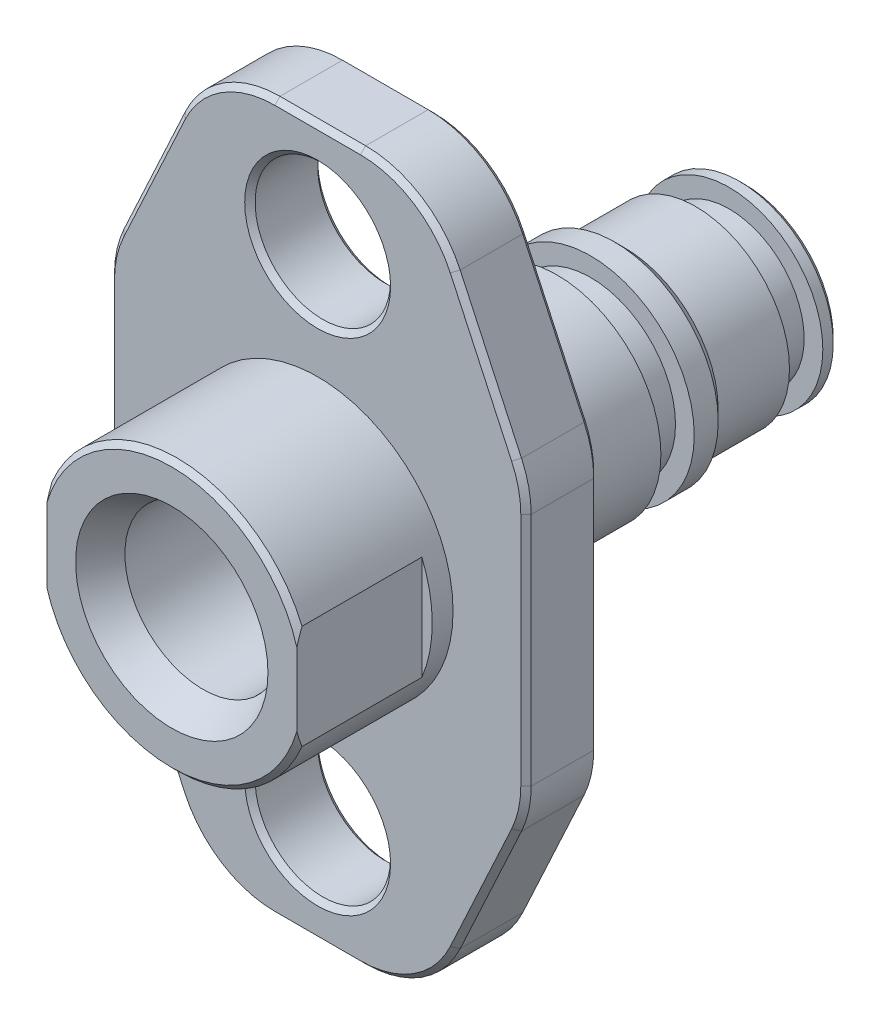
from build123d import *

# Parameters (mm, degrees)
SKETCH2_OUTSIDE_W  = 94.65
SKETCH2_OUTSIDE_H  = 94.65
SKETCH2_OUTSIDE_R  = 6.5
CUT_EXTRUDE1_DEPTH = 21
SKETCH5_W          = 2.091476768
SKETCH5_H          = 18
CUT_EXTRUDE2_DEPTH = 12
CIRPATTERN1_COUNT  = 2
CIRPATTERN1_ANGLE  = 180
CHAMFER1_SIZE      = 0.5


with BuildPart() as part:
    # Sketch1 → Revolve1 (revolve)
    with BuildSketch(Plane(origin=(0, 0, 0), x_dir=(0, 0, -1), z_dir=(1, 0, 0)), mode=Mode.PRIVATE) as revolve1_sk:
        Polygon((14, 35), (21, 35), (21, 9.95), (37, 9.95), (37, 8.15), (40.2, 8.15), (40.2, 9.95), (42.5, 9.95), (43.46, 8.99), (50.3, 8.99), (50.3, 7.2), (53.5, 7.2), (53.5, 8.99), (54.5, 8.99), (55, 8.49), (55, 4.75), (18.652366702, 4.75), (17, 7.5), (3, 7.5), (0, 9.232050808), (0, 12.5), (0.5, 13), (14, 13), align=None)
    revolve(revolve1_sk.sketch.rotate(Axis((0, 0, 0), (0, 0, -1)), 90), axis=Axis((0, 0, 0), (0, 0, -1)))

    # Sketch2 outside → Cut-Extrude1 (cut)
    # profile 1 of 3: a face of its own
    with BuildSketch(Plane.XY):
        Rectangle(SKETCH2_OUTSIDE_W, SKETCH2_OUTSIDE_H)
        with BuildLine():
            Line((-4.112562412, 34), (4.112562412, 34))
            ThreePointArc((4.112562412, 34), (9.495586596, 32.427517466), (13.185668477, 28.204610128))
            Line((13.185668477, 28.204610128), (19.073106065, 15.500139543))
            ThreePointArc((19.073106065, 15.500139543), (19.765527652, 13.448311261), (20, 11.295529415))
            Line((20, 11.295529415), (20, -11.295529415))
            ThreePointArc((20, -11.295529415), (19.765527652, -13.448311261), (19.073106065, -15.500139543))
            Line((19.073106065, -15.500139543), (13.185668477, -28.204610128))
            ThreePointArc((13.185668477, -28.204610128), (9.495586596, -32.427517466), (4.112562412, -34))
            Line((4.112562412, -34), (-4.112562412, -34))
            ThreePointArc((-4.112562412, -34), (-9.495586596, -32.427517466), (-13.185668477, -28.204610128))
            Line((-13.185668477, -28.204610128), (-19.073106065, -15.500139543))
            ThreePointArc((-19.073106065, -15.500139543), (-19.765527652, -13.448311261), (-20, -11.295529415))
            Line((-20, -11.295529415), (-20, 11.295529415))
            ThreePointArc((-20, 11.295529415), (-19.765527652, 13.448311261), (-19.073106065, 15.500139543))
            Line((-19.073106065, 15.500139543), (-13.185668477, 28.204610128))
            ThreePointArc((-13.185668477, 28.204610128), (-9.495586596, 32.427517466), (-4.112562412, 34))
        make_face(mode=Mode.SUBTRACT)
    # profile 2 of 3: a face of its own
    with BuildSketch(Plane.XY):
        with Locations((0, 24)):
            Circle(SKETCH2_OUTSIDE_R)
    # profile 3 of 3: a face of its own
    with BuildSketch(Plane.XY):
        with Locations((0, -24)):
            Circle(SKETCH2_OUTSIDE_R)
    extrude(amount=-CUT_EXTRUDE1_DEPTH, mode=Mode.SUBTRACT)

    # Sketch5 → Cut-Extrude2 (cut)
    with BuildSketch(Plane.XY):
        with Locations((-13.045738384, -0.152764218)):
            Rectangle(SKETCH5_W, SKETCH5_H)
    cut_extrude2 = extrude(amount=-CUT_EXTRUDE2_DEPTH, mode=Mode.SUBTRACT)

    # CirPattern1: Cut-Extrude2 ×2 about axis
    cirpattern1_axis = Axis((0, 0, 0), (0, 0, 1))
    for i in range(1, CIRPATTERN1_COUNT):
        add(cut_extrude2.rotate(cirpattern1_axis, i * CIRPATTERN1_ANGLE / (CIRPATTERN1_COUNT - 1)), mode=Mode.SUBTRACT)

    # Chamfer1
    chamfer1_edges = [part.edges().sort_by_distance(p)[0] for p in [
        (-6.5, 24, -21),
        (-6.5, 24, -14),
        (-6.5, -24, -21),
        (-6.5, -24, -14),
        (20, 0, -21),
        (19.765527652, 13.448311261, -21),
        (16.129387271, 21.852374836, -21),
        (9.495586596, 32.427517466, -21),
        (0, 34, -21),
        (-9.495586596, 32.427517466, -21),
        (-16.129387271, 21.852374836, -21),
        (-19.765527652, 13.448311261, -21),
        (-20, 0, -21),
        (-19.765527652, -13.448311261, -21),
        (-16.129387271, -21.852374836, -21),
        (-9.495586596, -32.427517466, -21),
        (0, -34, -21),
        (9.495586596, -32.427517466, -21),
        (16.129387271, -21.852374836, -21),
        (19.765527652, -13.448311261, -21),
        (19.765527652, 13.448311261, -14),
        (20, 0, -14),
        (19.765527652, -13.448311261, -14),
        (16.129387271, -21.852374836, -14),
        (9.495586596, -32.427517466, -14),
        (0, -34, -14),
        (-9.495586596, -32.427517466, -14),
        (-16.129387271, -21.852374836, -14),
        (-19.765527652, -13.448311261, -14),
        (-20, 0, -14),
        (-19.765527652, 13.448311261, -14),
        (-16.129387271, 21.852374836, -14),
        (-9.495586596, 32.427517466, -14),
        (0, 34, -14),
        (9.495586596, 32.427517466, -14),
        (16.129387271, 21.852374836, -14),
    ]]
    chamfer(chamfer1_edges, length=CHAMFER1_SIZE)


solid = part.part
